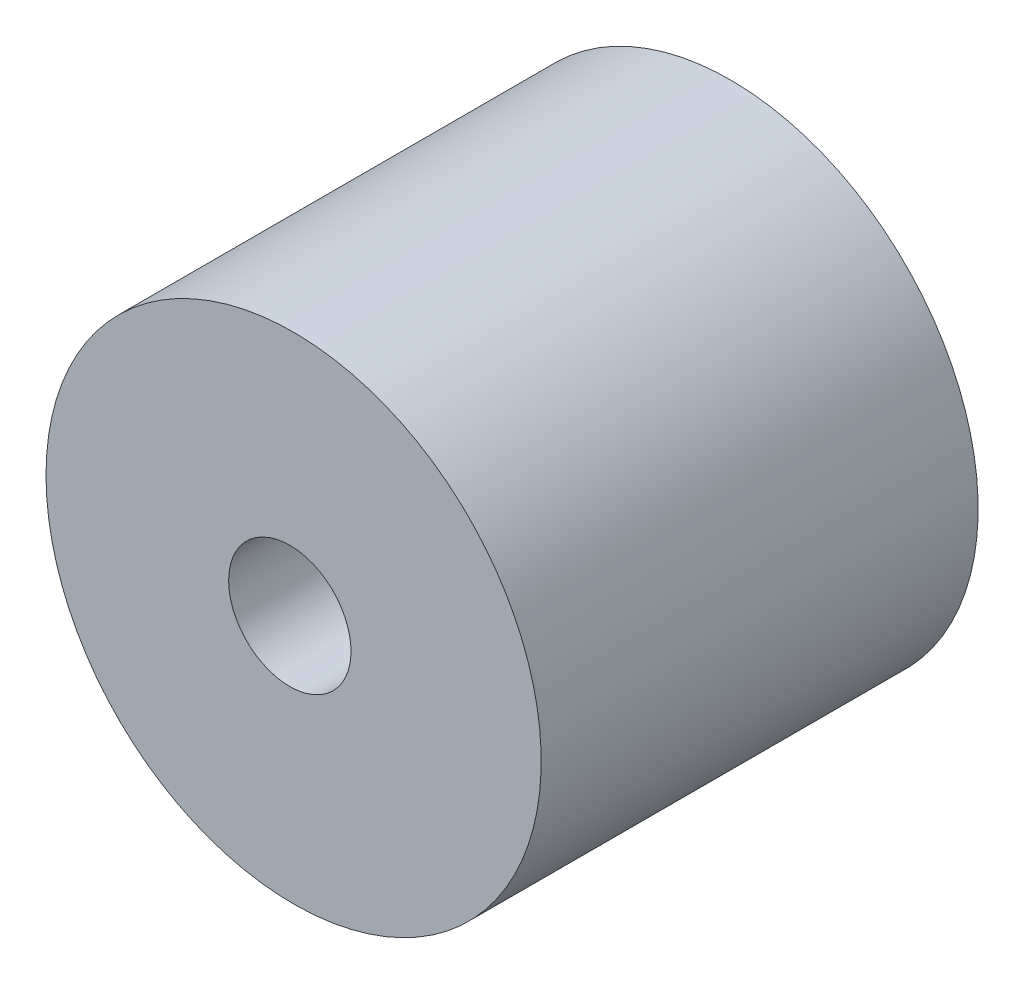
from build123d import *

# Parameters (mm, degrees)
SKETCH1_R           = 10.795
SKETCH1_R_2         = 2.667
BOSS_EXTRUDE1_DEPTH = 19.05


with BuildPart() as part:
    # Sketch1 → Boss-Extrude1 (new body)
    with BuildSketch(Plane.XY):
        with Locations(Location((0.165429311, 0, 0), (0, 0, 180))):
            Circle(SKETCH1_R)
        with Locations(Location((0, 0, 0), (0, 0, 180))):
            Circle(SKETCH1_R_2, mode=Mode.SUBTRACT)
    extrude(amount=BOSS_EXTRUDE1_DEPTH)


solid = part.part
